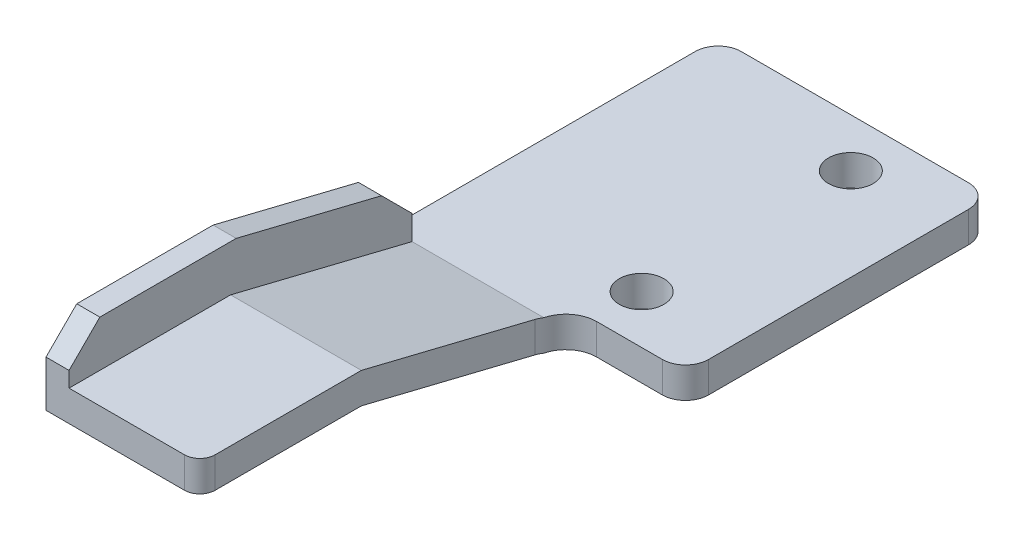
from build123d import *

# Parameters (mm, degrees)
SKETCH1_W           = 17.77
SKETCH1_H           = 19.9
SKETCH1_R           = 1.45
BOSS_EXTRUDE1_DEPTH = 2
BOSS_EXTRUDE2_DEPTH = 10
BOSS_EXTRUDE4_DEPTH = 1.5
CHAMFER1_SIZE       = 2
CHAMFER2_SIZE       = 1.5
CHAMFER2_SIZE2      = 2.047943534
FILLET1_R           = 1.5
FILLET2_R           = 1
FILLET3_R           = 2


with BuildPart() as part:
    # Sketch1 → Boss-Extrude1 (new body)
    with BuildSketch(Plane(origin=(0, 0, 0), x_dir=(1, 0, 0), z_dir=(0, 1, 0))):
        Rectangle(SKETCH1_W, SKETCH1_H)
        with Locations(Location((2.885, 6.8, 0), (0, 0, 270))):
            Circle(SKETCH1_R, mode=Mode.SUBTRACT)
        with Locations(Location((2.885, -6.8, 0), (0, 0, 270))):
            Circle(SKETCH1_R, mode=Mode.SUBTRACT)
    extrude(amount=BOSS_EXTRUDE1_DEPTH)

    # Sketch2 → Boss-Extrude2 (add)
    with BuildSketch(Plane.ZY.offset(8.885)):
        Polygon((9.95, 2), (11.45, 2), (23.25, 4.9), (33.75, 4.9), (33.75, 2.9), (23.25, 2.9), (11.45, 0), (9.95, 0), align=None)
    extrude(amount=-BOSS_EXTRUDE2_DEPTH)

    # Sketch4 → Boss-Extrude4 (add)
    with BuildSketch(Plane.ZY.offset(8.885)):
        Polygon((33.75, 4.9), (23.25, 4.9), (11.45, 2), (11.45, 5.089270755), (22.886760378, 7.9), (33.75, 7.9), align=None)
    extrude(amount=-BOSS_EXTRUDE4_DEPTH)

    # Chamfer1
    chamfer1_edges = [part.edges().sort_by_distance(p)[0] for p in [
        (-8.135, 7.9, 33.75),
    ]]
    chamfer(chamfer1_edges, length=CHAMFER1_SIZE)

    # Chamfer2
    chamfer2_edges = [part.edges().sort_by_distance(p)[0] for p in [
        (-8.135, 5.089270755, 11.45),
    ]]
    chamfer2_side = [part.faces().sort_by_distance(p)[0] for p in [
        (-8.135, 3.544635377, 11.45),
    ]]
    chamfer(chamfer2_edges, length=CHAMFER2_SIZE, length2=CHAMFER2_SIZE2, reference=chamfer2_side[0])

    # Fillet1
    fillet1_edges = [part.edges().sort_by_distance(p)[0] for p in [
        (-8.885, 1, -9.95),
        (8.885, 1, -9.95),
        (8.885, 1, 9.95),
    ]]
    fillet(fillet1_edges, radius=FILLET1_R)

    # Fillet2
    fillet2_edges = [part.edges().sort_by_distance(p)[0] for p in [
        (1.115, 3.9, 33.75),
    ]]
    fillet(fillet2_edges, radius=FILLET2_R)

    # Fillet3
    fillet3_edges = [part.edges().sort_by_distance(p)[0] for p in [
        (1.115, 1, 9.95),
    ]]
    fillet(fillet3_edges, radius=FILLET3_R)


solid = part.part
